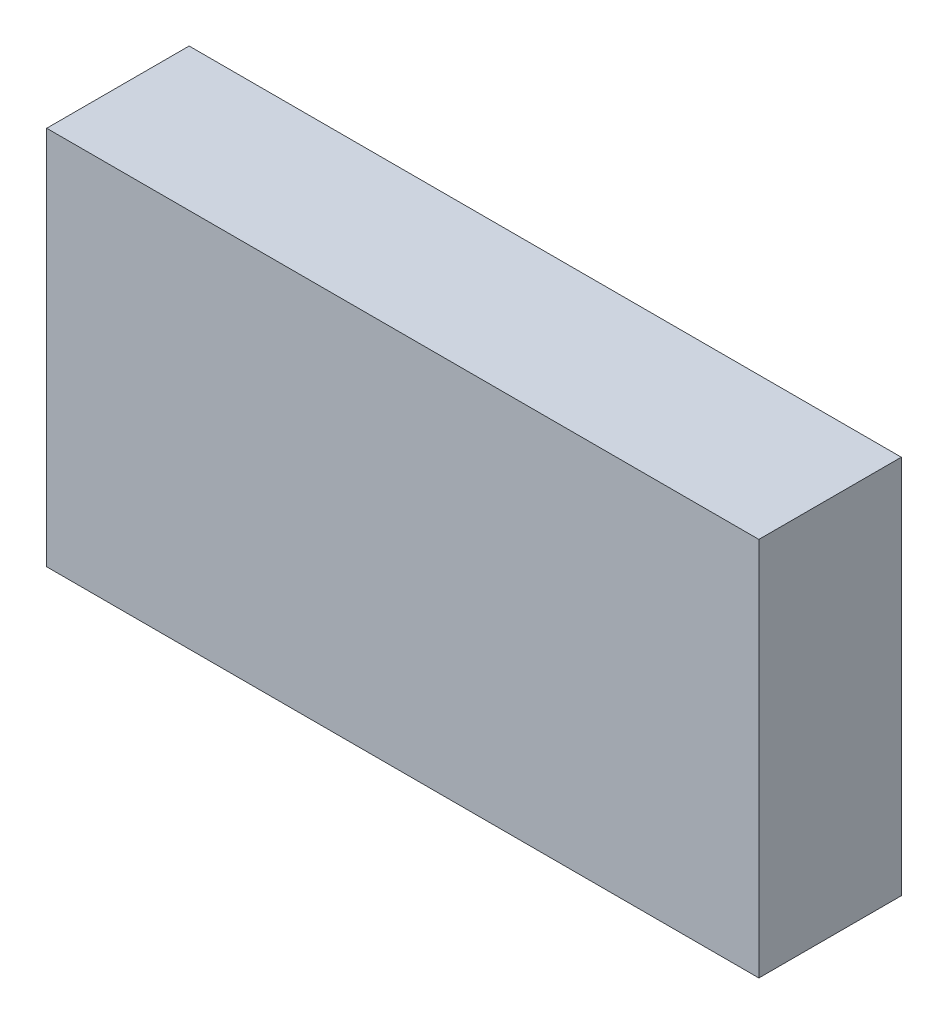
from build123d import *

# Parameters (mm, degrees)
SKETCH1_W                        = 15
SKETCH1_H                        = 8
CEK_TAZE_MIKNATIS_15X8X3_1_DEPTH = 3


with BuildPart() as part:
    # Sketch1 → CEK_taze_miknatis_15x8x3_1 (new body)
    with BuildSketch(Plane.XY):
        with Locations((603.5, 77)):
            Rectangle(SKETCH1_W, SKETCH1_H)
    extrude(amount=-CEK_TAZE_MIKNATIS_15X8X3_1_DEPTH)


solid = part.part
